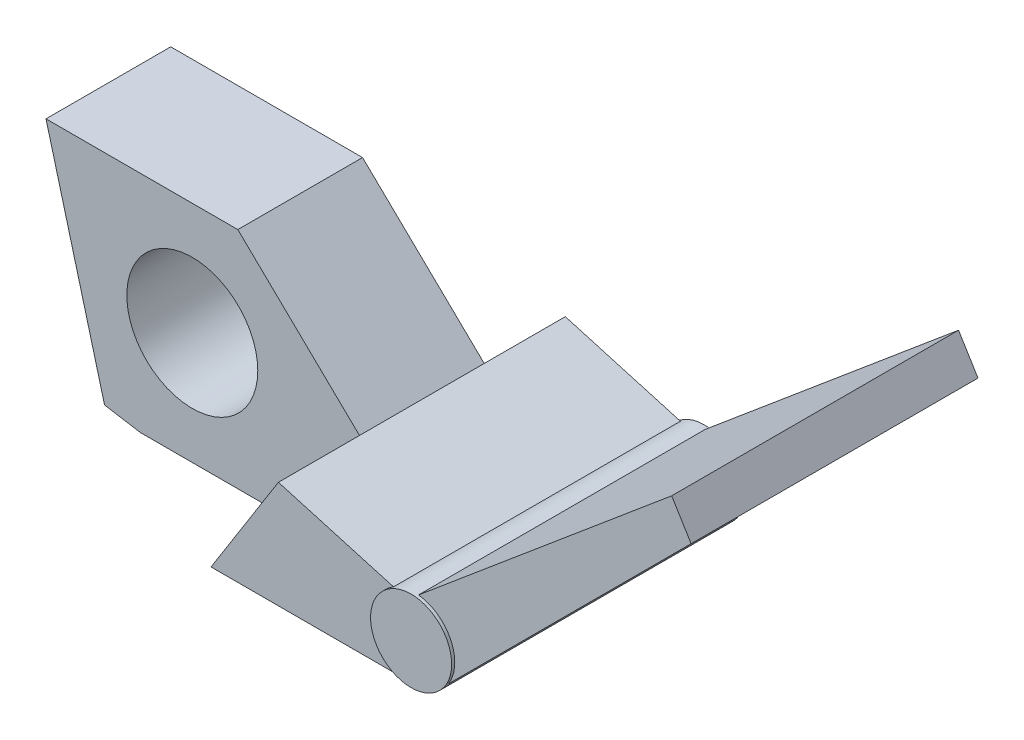
from build123d import *

# Parameters (mm, degrees)
SKETCH2_R           = 5.25
BOSS_EXTRUDE1_DEPTH = 5
BOSS_EXTRUDE2_DEPTH = 11.5
BOSS_EXTRUDE3_DEPTH = 11.75
CUT_EXTRUDE1_DEPTH  = 10
BOSS_EXTRUDE4_DEPTH = 10


with BuildPart() as part:
    # Sketch2 → Boss-Extrude1 (new, symmetric)
    with BuildSketch(Plane.XY):
        Polygon((3.65, 9), (-9, 9), (-9, -9), (8, -9), (13.404247693, -0.419567503), align=None)
        Circle(SKETCH2_R, mode=Mode.SUBTRACT)
    extrude(amount=BOSS_EXTRUDE1_DEPTH, both=True)

    # Sketch2<15> → Boss-Extrude2 (add, symmetric)
    with BuildSketch(Plane.XY):
        with BuildLine():
            Line((13.404247693, -0.419567503), (8, -9))
            Line((8, -9), (23.45, -9))
            ThreePointArc((23.45, -9), (21.073071329, -6.303811499), (22.634247693, -3.066227414))
            Line((22.634247693, -3.066227414), (13.404247693, -0.419567503))
        make_face()
        with BuildLine():
            ThreePointArc((24.632481869, -2.628978571), (27.214625143, -4.438023244), (27.047099939, -7.586362779))
            Line((27.047099939, -7.586362779), (46.492536422, 11.859073704))
            Line((46.492536422, 11.859073704), (44.932659612, 14.404893086))
            Line((44.932659612, 14.404893086), (24.632481869, -2.628978571))
        make_face()
    extrude(amount=BOSS_EXTRUDE2_DEPTH, both=True)


with BuildPart() as boss_extrude2_piece_1:
    # of the separate pieces the step leaves, piece 1, a body of its own (boss_extrude2_pieces)
    add(part.part.solids().sort_by_distance((22.634247693, -3.066227414, -11.5))[0])



with BuildPart() as boss_extrude2_piece_2:
    # of the separate pieces the step leaves, piece 2, a body of its own (boss_extrude2_pieces)
    add(part.part.solids().sort_by_distance((24.632481869, -2.628978571, -11.5))[0])


with BuildPart() as boss_extrude2_piece_1_1:
    add(boss_extrude2_piece_1.part)

    add(boss_extrude2_piece_2.part)  # Boss-Extrude3 merges Boss-Extrude2 piece 2
    # Sketch2<16> → Boss-Extrude3 (add, symmetric)
    with BuildSketch(Plane.XY):
        with BuildLine():
            ThreePointArc((22.634247693, -3.066227414), (21.073071329, -6.303811499), (23.45, -9))
            ThreePointArc((23.45, -9), (25.48151566, -8.885979074), (27.047099939, -7.586362779))
            ThreePointArc((27.047099939, -7.586362779), (27.416408735, -6.7586698), (27.542787913, -5.861177206))
            ThreePointArc((27.542787913, -5.861177206), (26.708000673, -3.686493937), (24.632481869, -2.628978571))
            ThreePointArc((24.632481869, -2.628978571), (23.598068182, -2.686296972), (22.634247693, -3.066227414))
        make_face()
    extrude(amount=BOSS_EXTRUDE3_DEPTH, both=True)

    # Sketch3 → Cut-Extrude1 (cut)
    with BuildSketch(Plane(origin=(0, 0, -5), x_dir=(-1, 0, 0), z_dir=(0, 0, -1))):
        Polygon((9, 9), (9, -9), (4.176914536, -9), align=None)
    extrude(amount=-CUT_EXTRUDE1_DEPTH, mode=Mode.SUBTRACT)

    # Sketch4 → Boss-Extrude4 (add)
    with BuildSketch(Plane(origin=(0, 0, -5), x_dir=(-1, 0, 0), z_dir=(0, 0, -1))):
        Polygon((9, 9), (11.729028356, 9), (7.033855882, -8.522622223), (4.176914536, -9), align=None)
    extrude(amount=-BOSS_EXTRUDE4_DEPTH)


solid = boss_extrude2_piece_1_1.part
